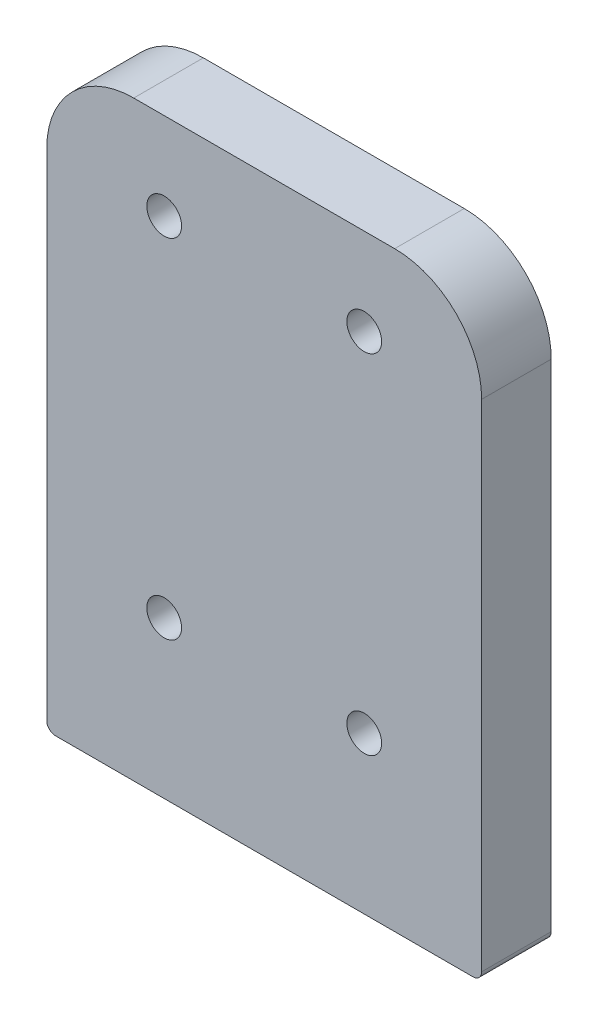
from build123d import *

# Parameters (mm, degrees)
SKETCH_1_W                   = 50
SKETCH_1_H                   = 68
EXTRUDE_1_DEPTH              = 8
SKETCH_2_R                   = 2
CUT_EXTRUDE_1_DEPTH          = 43.95346319
HOLE_WIZARD_M4_1_D           = 3.3
HOLE_WIZARD_M4_1_DEPTH       = 10.1
HOLE_WIZARD_M4_1_CSINK_D     = 4.05
HOLE_WIZARD_M4_1_CSINK_ANGLE = 90
HOLE_WIZARD_M4_1_TIP         = 0.991420021
MM_1_D                       = 3
MM_1_DEPTH                   = 8
MM_1_TIP                     = 0.901290929
FILLET_1_R                   = 10
FILLET_2_R                   = 1


with BuildPart() as part:
    # 草图1 → 凸台-拉伸1 (new body)
    with BuildSketch(Plane.XY):
        Rectangle(SKETCH_1_W, SKETCH_1_H)
    extrude(amount=EXTRUDE_1_DEPTH)

    # 草图2 → 切除-拉伸1 (cut, through all)
    with BuildSketch(Plane.XY.offset(8)):
        with Locations((-11.5, -16)):
            Circle(SKETCH_2_R)
        with Locations((-11.5, 24)):
            Circle(SKETCH_2_R)
        with Locations(Location((11.5, 24, 0), (0, 0, 180))):
            Circle(SKETCH_2_R)
        with Locations(Location((11.5, -16, 0), (0, 0, 180))):
            Circle(SKETCH_2_R)
    extrude(amount=-CUT_EXTRUDE_1_DEPTH, mode=Mode.SUBTRACT)

    # M4 螺纹孔1
    with Locations(Plane(origin=(-20, -34, 4), x_dir=(0, 0, -1), z_dir=(0, -1, 0))):
        with Locations((0, 0), (0, 40)):
            CounterSinkHole(HOLE_WIZARD_M4_1_D / 2, HOLE_WIZARD_M4_1_CSINK_D / 2, depth=HOLE_WIZARD_M4_1_DEPTH, counter_sink_angle=HOLE_WIZARD_M4_1_CSINK_ANGLE)
            with Locations((0, 0, -(HOLE_WIZARD_M4_1_DEPTH + HOLE_WIZARD_M4_1_TIP / 2))):  # 118° drill point
                Cone(0, HOLE_WIZARD_M4_1_D / 2, HOLE_WIZARD_M4_1_TIP, mode=Mode.SUBTRACT)

    # 大小mm 暗销孔1
    with Locations(Plane(origin=(-12.5, -34, 4), x_dir=(0, 0, -1), z_dir=(0, -1, 0))):
        with Locations((0, 0), (0, 25)):
            Hole(MM_1_D / 2, depth=MM_1_DEPTH)
            with Locations((0, 0, -(MM_1_DEPTH + MM_1_TIP / 2))):  # 118° drill point
                Cone(0, MM_1_D / 2, MM_1_TIP, mode=Mode.SUBTRACT)

    # 圆角1
    fillet_1_edges = [part.edges().sort_by_distance(p)[0] for p in [
        (-25, 34, 4),
        (25, 34, 4),
    ]]
    fillet(fillet_1_edges, radius=FILLET_1_R)

    # 圆角2
    fillet_2_edges = [part.edges().sort_by_distance(p)[0] for p in [
        (25, -34, 4),
        (-25, -34, 4),
    ]]
    fillet(fillet_2_edges, radius=FILLET_2_R)


solid = part.part
